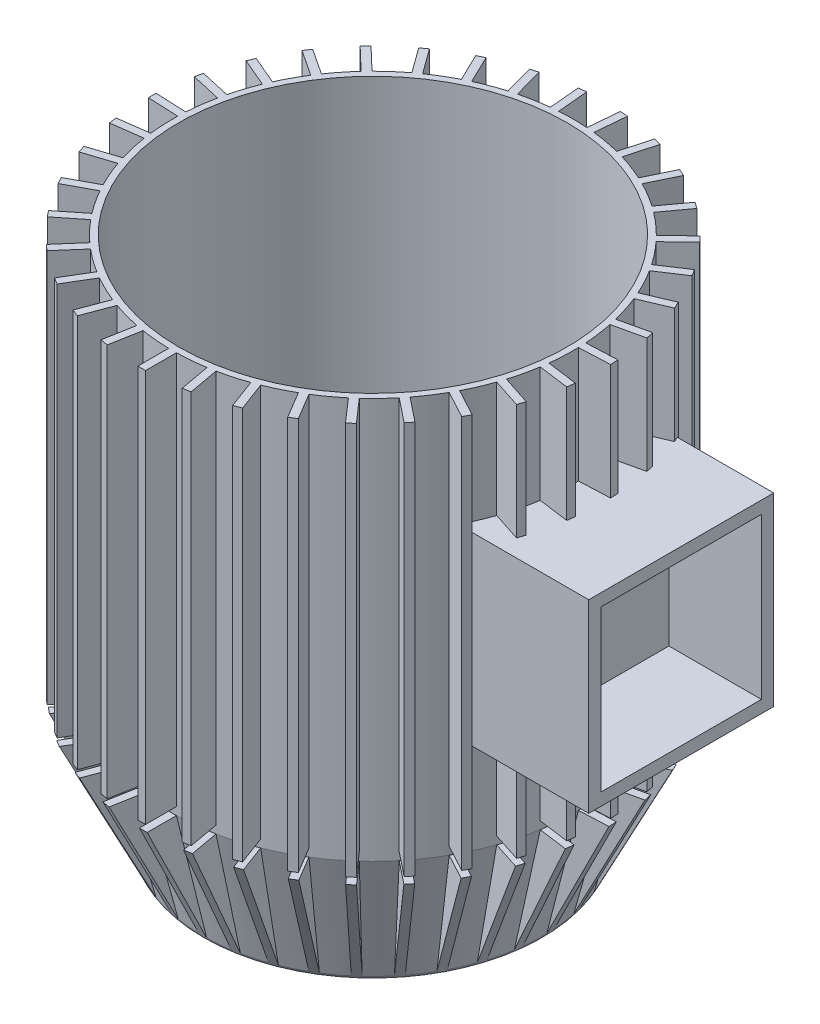
from build123d import *

# Parameters (mm, degrees)
SKETCH1_R           = 65
BOSS_EXTRUDE1_DEPTH = 170
CHAMFER1_SIZE       = 10
CHAMFER1_SIZE2      = 40
SHELL1_T            = -2
BOSS_EXTRUDE2_REACH = 231.619
SKETCH2_W           = 2.5
SKETCH2_H           = 170
CIRPATTERN1_COUNT   = 35
SKETCH4_R           = 10
CUT_EXTRUDE1_DEPTH  = 201.367373921
BOSS_EXTRUDE3_REACH = 257.232
SKETCH5_W           = 60
SKETCH5_H           = 60
SKETCH6_W           = 52
SKETCH6_H           = 52
CUT_EXTRUDE2_DEPTH  = 30


with BuildPart() as part:
    # Sketch1 → Boss-Extrude1 (new body)
    with BuildSketch(Plane(origin=(0, 0, 0), x_dir=(1, 0, 0), z_dir=(0, 1, 0))):
        with Locations(Location((0, 0, 0), (0, 0, 270))):
            Circle(SKETCH1_R)
    extrude(amount=-BOSS_EXTRUDE1_DEPTH)

    # Chamfer1
    chamfer1_edges = [part.edges().sort_by_distance(p)[0] for p in [
        (0, -170, -65),
    ]]
    chamfer1_side = [part.faces().sort_by_distance(p)[0] for p in [
        (0, -170, 0),
    ]]
    chamfer(chamfer1_edges, length=CHAMFER1_SIZE, length2=CHAMFER1_SIZE2, reference=chamfer1_side[0])

    # Shell1
    shell1_openings = [part.faces().sort_by_distance(p)[0] for p in [
        (0, 0, 0),
    ]]
    offset(amount=SHELL1_T, openings=shell1_openings, kind=Kind.INTERSECTION)

    # Sketch2 → Boss-Extrude2 (add, up to next)
    with BuildSketch(Plane.XY.offset(75), mode=Mode.PRIVATE) as boss_extrude2_sk1:
        with Locations((0, -85)):
            Rectangle(SKETCH2_W, SKETCH2_H)
    boss_extrude2_tool1 = extrude(boss_extrude2_sk1.sketch, amount=-BOSS_EXTRUDE2_REACH, mode=Mode.PRIVATE) - part.part
    boss_extrude2 = boss_extrude2_tool1.solids().sort_by_distance((0, -85, 75))[0]
    add(boss_extrude2)

    # CirPattern1: Boss-Extrude2 ×35 about axis
    cirpattern1_axis = Axis((0, 0, 0), (0, 1, 0))
    for i in range(1, CIRPATTERN1_COUNT):
        add(boss_extrude2.rotate(cirpattern1_axis, i * 360 / CIRPATTERN1_COUNT))

    # Sketch3 → Cut-Revolve1 (revolve, cut)
    with BuildSketch(Plane.XY, mode=Mode.PRIVATE) as cut_revolve1_sk:
        Polygon((54.827975335, -170), (80.936486897, -178.748528327), (80.936486897, -127.5), (65, -127.5), (65, -130), (74.489023715, -130), align=None)
    revolve(cut_revolve1_sk.sketch.rotate(Axis((0, 0, 0), (0, -1, 0)), 88.898090161), axis=Axis((0, 0, 0), (0, -1, 0)), mode=Mode.SUBTRACT)

    # Sketch4 → Cut-Extrude1 (cut, through all)
    with BuildSketch(Plane.XZ.offset(170)):
        with Locations(Location((0, 0, 0), (0, 0, 270))):
            Circle(SKETCH4_R)
    extrude(amount=-CUT_EXTRUDE1_DEPTH, mode=Mode.SUBTRACT)

    # Sketch5 → Boss-Extrude3 (add, up to next)
    with BuildSketch(Plane(origin=(100, 0, 0), x_dir=(0, 0, -1), z_dir=(1, 0, 0)), mode=Mode.PRIVATE) as boss_extrude3_sk1:
        with Locations((0, -67.5)):
            Rectangle(SKETCH5_W, SKETCH5_H)
    boss_extrude3_tool1 = extrude(boss_extrude3_sk1.sketch, amount=-BOSS_EXTRUDE3_REACH, mode=Mode.PRIVATE) - part.part
    add(boss_extrude3_tool1.solids().sort_by_distance((100, -67.5, 0))[0])

    # Sketch6 → Cut-Extrude2 (cut)
    with BuildSketch(Plane(origin=(100, 0, 0), x_dir=(0, 0, -1), z_dir=(1, 0, 0))):
        with Locations((0, -67.5)):
            Rectangle(SKETCH6_W, SKETCH6_H)
    extrude(amount=-CUT_EXTRUDE2_DEPTH, mode=Mode.SUBTRACT)


solid = part.part
